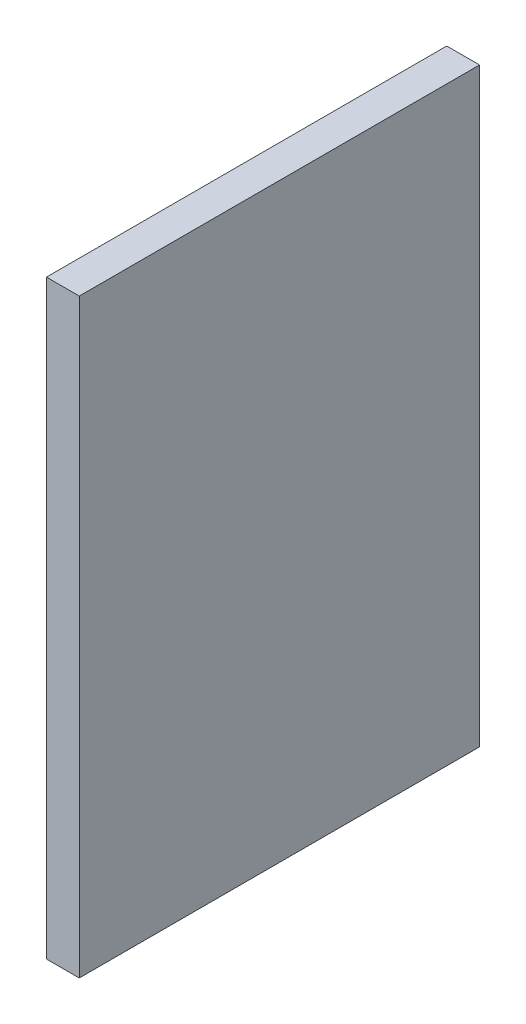
from build123d import *

# Parameters (mm, degrees)
SKETCH1_W           = 77.47
SKETCH1_H           = 114.3
BOSS_EXTRUDE1_DEPTH = 6.35


with BuildPart() as part:
    # Sketch1 → Boss-Extrude1 (new body)
    with BuildSketch(Plane(origin=(0, 0, 0), x_dir=(0, 0, -1), z_dir=(1, 0, 0))):
        with Locations((38.735, 57.15)):
            Rectangle(SKETCH1_W, SKETCH1_H)
    extrude(amount=BOSS_EXTRUDE1_DEPTH)


solid = part.part
